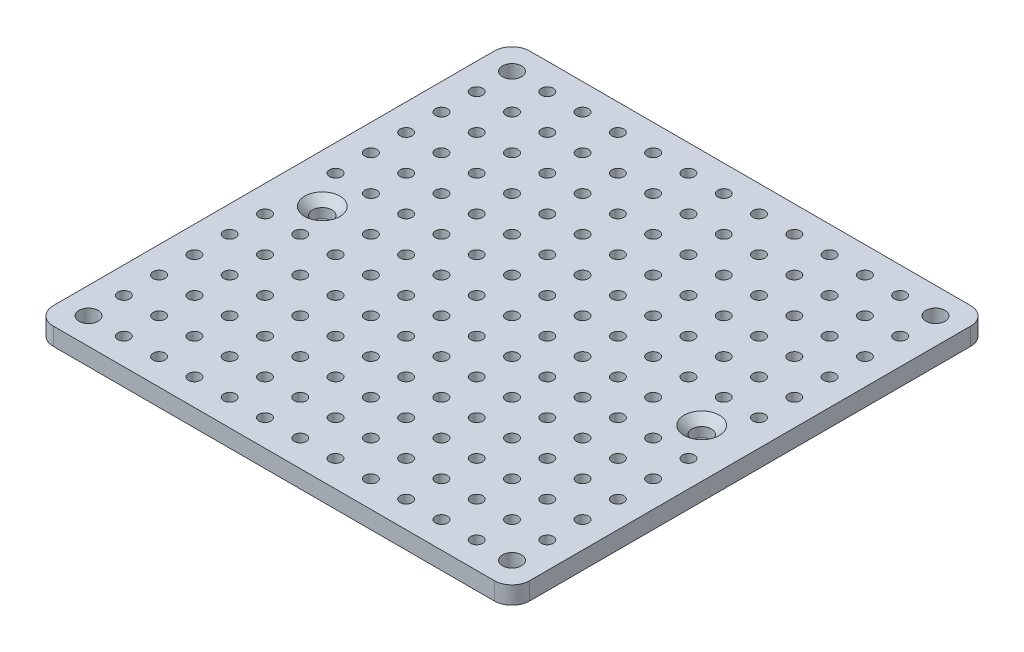
from build123d import *

# Parameters (mm, degrees)
SKETCH1_W                                     = 270
SKETCH1_H                                     = 270
BOSS_EXTRUDE1_DEPTH                           = 10
SKETCH4_W                                     = 140
SKETCH4_H                                     = 30
SKETCH4_W_2                                   = 270
BOSS_EXTRUDE2_DEPTH                           = 10
FILLET1_R                                     = 10
BOSS_EXTRUDE3_DEPTH                           = 10
M8X1_25_TAPPED_HOLE1_D                        = 6.8
MIRROR2_COPY_1_D                              = 6.8
CSK_FOR_M10_FLAT_HEAD_MACHINE_SCREW1_AT_COUNT = 2
CSK_FOR_M10_FLAT_HEAD_MACHINE_SCREW1_AT_PITCH = 215
SKETCH13_R                                    = 5
CUT_EXTRUDE1_DEPTH                            = 192.180542943
M12X1_25_TAPPED_HOLE3_D                       = 10.8


with BuildPart() as part:
    # Sketch1 → Boss-Extrude1 (new body)
    with BuildSketch(Plane(origin=(0, 0, 0), x_dir=(1, 0, 0), z_dir=(0, 1, 0))):
        Rectangle(SKETCH1_W, SKETCH1_H)
    extrude(amount=BOSS_EXTRUDE1_DEPTH)

    # Sketch4 → Boss-Extrude2 (add)
    with BuildSketch(Plane(origin=(0, 10, 0), x_dir=(1, 0, 0), z_dir=(0, 1, 0))):
        Polygon((-135, 135), (-75.839202169, 135), (-75.839202169, 75), (-95, 75), (-95, -80), (-75.839202169, -80), (-75.839202169, -100), (-135, -100), (-135, -90), (-135, 85), align=None)
        Polygon((135, 135), (75.839202169, 135), (75.839202169, 75), (95, 75), (95, -80), (74.160797831, -80), (74.160797831, -100), (135, -100), (135, -90), (135, 85), align=None)
        with Locations((-0.339202169, 120)):
            Rectangle(SKETCH4_W, SKETCH4_H)
        with Locations((0, -120)):
            Rectangle(SKETCH4_W_2, SKETCH4_H)
    extrude(amount=-BOSS_EXTRUDE2_DEPTH)

    # Fillet1
    fillet1_edges = [part.edges().sort_by_distance(p)[0] for p in [
        (135, 5, 135),
        (-135, 5, 135),
        (-135, 5, -135),
        (135, 5, -135),
    ]]
    fillet(fillet1_edges, radius=FILLET1_R)

    # Sketch6 → Boss-Extrude3 (add)
    with BuildSketch(Plane(origin=(0, 10, 0), x_dir=(1, 0, 0), z_dir=(0, 1, 0))):
        with BuildLine():
            Line((31.622776602, 15), (45, 15))
            Line((45, 15), (45, -15))
            Line((45, -15), (31.622776602, -15))
            ThreePointArc((31.622776602, -15), (0, -35), (-31.622776602, -15))
            Line((-31.622776602, -15), (-45, -15))
            Line((-45, -15), (-45, 15))
            Line((-45, 15), (-31.622776602, 15))
            ThreePointArc((-31.622776602, 15), (0, 35), (31.622776602, 15))
        make_face()
    extrude(amount=-BOSS_EXTRUDE3_DEPTH)

    # M8x1.25 Tapped Hole1 (through all)
    with Locations(Plane(origin=(0, 10, 0), x_dir=(1, 0, 0), z_dir=(0, 1, 0))):
        with Locations((0, 120), (20, 120), (40, 120), (60, 120), (80, 120), (100, 120), (120, 120), (120, 100), (100, 100), (80, 100), (60, 100), (40, 100), (20, 100), (0, 100), (0, 80), (20, 80), (40, 80), (60, 80), (80, 80), (100, 80), (120, 80), (120, 60), (120, 40), (120, 20), (100, 20), (100, 40), (100, 60), (80, 60), (80, 40), (80, 20), (80, 0), (60, 0), (60, 20), (60, 40), (60, 60), (40, 60), (40, 40), (40, 20), (40, 0), (20, 0), (20, 20), (20, 40), (20, 60), (0, 60), (0, 40), (0, 20), (0, 0)):
            m8x1_25_tapped_hole1 = Hole(M8X1_25_TAPPED_HOLE1_D / 2)

    # Mirror1: M8x1.25 Tapped Hole1 across plane
    add(m8x1_25_tapped_hole1.mirror(Plane(origin=(0, 0, 0), x_dir=(0, 0, 1), z_dir=(1, 0, 0))), mode=Mode.SUBTRACT)

    # Mirror2: M8x1.25 Tapped Hole1 across plane
    add(m8x1_25_tapped_hole1.mirror(Plane.XY), mode=Mode.SUBTRACT)

    # Mirror2 copy 1 (through all)
    with Locations(Plane(origin=(0, 10, 0), x_dir=(-1, 0, 0), z_dir=(0, 1, 0))):
        with Locations((0, 120), (20, 120), (40, 120), (60, 120), (80, 120), (100, 120), (120, 120), (120, 100), (100, 100), (80, 100), (60, 100), (40, 100), (20, 100), (0, 100), (0, 80), (20, 80), (40, 80), (60, 80), (80, 80), (100, 80), (120, 80), (120, 60), (120, 40), (120, 20), (100, 20), (100, 40), (100, 60), (80, 60), (80, 40), (80, 20), (80, 0), (60, 0), (60, 20), (60, 40), (60, 60), (40, 60), (40, 40), (40, 20), (40, 0), (20, 0), (20, 20), (20, 40), (20, 60), (0, 60), (0, 40), (0, 20), (0, 0)):
            Hole(MIRROR2_COPY_1_D / 2)

    # Sketch12 → CSK for M10 Flat Head Machine Screw1 (revolve, cut)
    with BuildSketch(Plane(origin=(-107.5, 10, 0), x_dir=(0, 0, 1), z_dir=(1, 0, 0))):
        Polygon((0, 0), (0, 10), (5.5, 10), (5.5, 4.5), (10, 0), align=None)
    csk_for_m10_flat_head_machine_screw1 = revolve(axis=Axis((-107.5, 16.35, 0), (0, -1, 0)), mode=Mode.SUBTRACT)

    # CSK for M10 Flat Head Machine Screw1 at: CSK for M10 Flat Head Machine Screw1 ×2
    with Locations(*[(i * CSK_FOR_M10_FLAT_HEAD_MACHINE_SCREW1_AT_PITCH, 0, 0) for i in range(1, CSK_FOR_M10_FLAT_HEAD_MACHINE_SCREW1_AT_COUNT)]):
        add(csk_for_m10_flat_head_machine_screw1, mode=Mode.SUBTRACT)

    # Sketch13 → Cut-Extrude1 (cut, through all)
    with BuildSketch(Plane(origin=(0, 10, 0), x_dir=(1, 0, 0), z_dir=(0, 1, 0))):
        with Locations(Location((-120, 120, 0), (0, 0, 270))):
            Circle(SKETCH13_R)
        with Locations(Location((120, 120, 0), (0, 0, 270))):
            Circle(SKETCH13_R)
        with Locations(Location((120, -120, 0), (0, 0, 270))):
            Circle(SKETCH13_R)
        with Locations(Location((-120, -120, 0), (0, 0, 270))):
            Circle(SKETCH13_R)
    extrude(amount=-CUT_EXTRUDE1_DEPTH, mode=Mode.SUBTRACT)

    # M12x1.25 Tapped Hole3 (through all)
    with Locations(Plane(origin=(0, 10, 0), x_dir=(1, 0, 0), z_dir=(0, 1, 0))):
        with Locations((-120, -120), (120, -120), (120, 120), (-120, 120)):
            Hole(M12X1_25_TAPPED_HOLE3_D / 2)


solid = part.part
